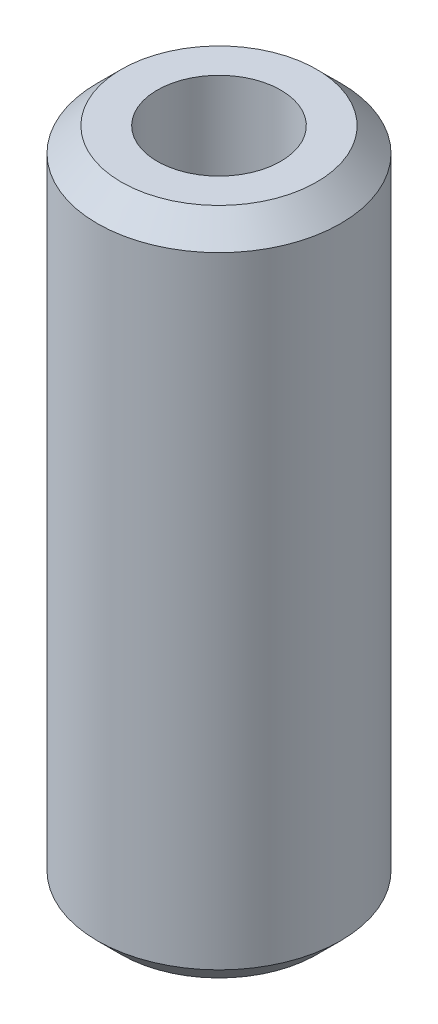
from build123d import *

# Parameters (mm, degrees)
SKETCH3_R           = 12.7
BOSS_EXTRUDE5_DEPTH = 69.85
SKETCH6_R           = 6.45
CUT_EXTRUDE1_DEPTH  = 73.122135992
CHAMFER1_SIZE       = 2.5
CHAMFER2_SIZE       = 2.5


with BuildPart() as part:
    # Sketch3 → Boss-Extrude5 (new body)
    with BuildSketch(Plane(origin=(0, 0, 0), x_dir=(1, 0, 0), z_dir=(0, 1, 0))):
        with Locations(Location((0, 0, 0), (0, 0, 270))):
            Circle(SKETCH3_R)
    extrude(amount=BOSS_EXTRUDE5_DEPTH)

    # Sketch6 → Cut-Extrude1 (cut, through all)
    with BuildSketch(Plane.XZ):
        with Locations(Location((0, 0, 0), (0, 0, 270))):
            Circle(SKETCH6_R)
    extrude(amount=-CUT_EXTRUDE1_DEPTH, mode=Mode.SUBTRACT)

    # Chamfer1
    chamfer1_edges = [part.edges().sort_by_distance(p)[0] for p in [
        (0, 69.85, -12.7),
    ]]
    chamfer(chamfer1_edges, length=CHAMFER1_SIZE)

    # Chamfer2
    chamfer2_edges = [part.edges().sort_by_distance(p)[0] for p in [
        (0, 0, -12.7),
    ]]
    chamfer(chamfer2_edges, length=CHAMFER2_SIZE)


solid = part.part
